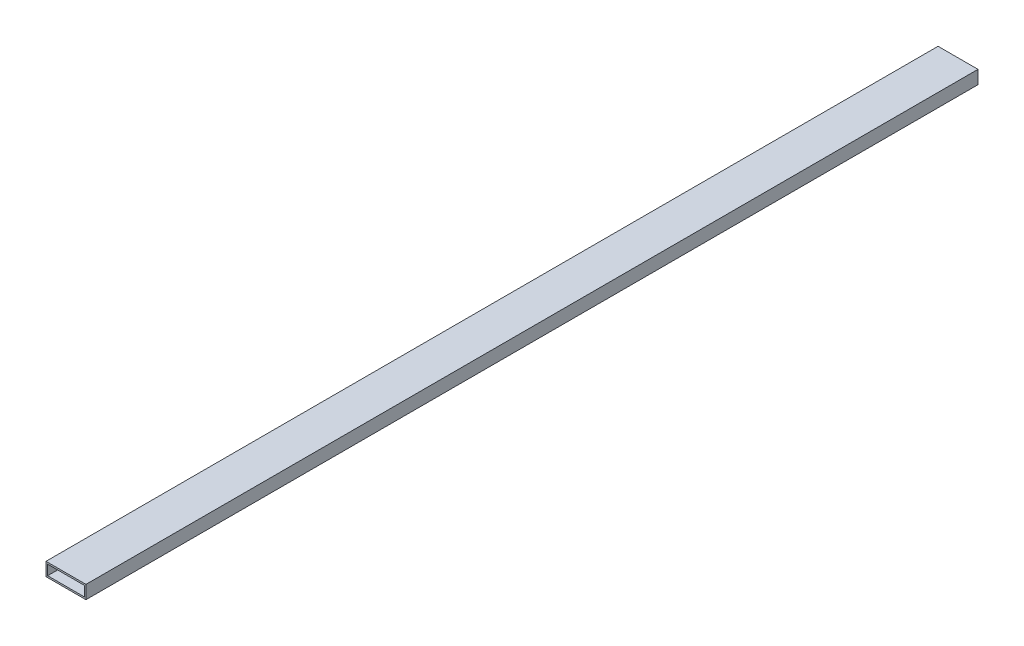
from build123d import *

# Parameters (mm, degrees)
SKETCH1_W      = 76.2
SKETCH1_H      = 25.4
EXTRUDE1_DEPTH = 850.9
SKETCH2_W      = 69.85
SKETCH2_H      = 19.05
EXTRUDE2_DEPTH = 1703.273814637


with BuildPart() as part:
    # Sketch1 → Extrude1 (new, symmetric)
    with BuildSketch(Plane.XY):
        Rectangle(SKETCH1_W, SKETCH1_H)
    extrude(amount=EXTRUDE1_DEPTH, both=True)

    # Sketch2 → Extrude2 (cut, through all)
    with BuildSketch(Plane.XY.offset(850.9)):
        Rectangle(SKETCH2_W, SKETCH2_H)
    extrude(amount=-EXTRUDE2_DEPTH, mode=Mode.SUBTRACT)


solid = part.part
